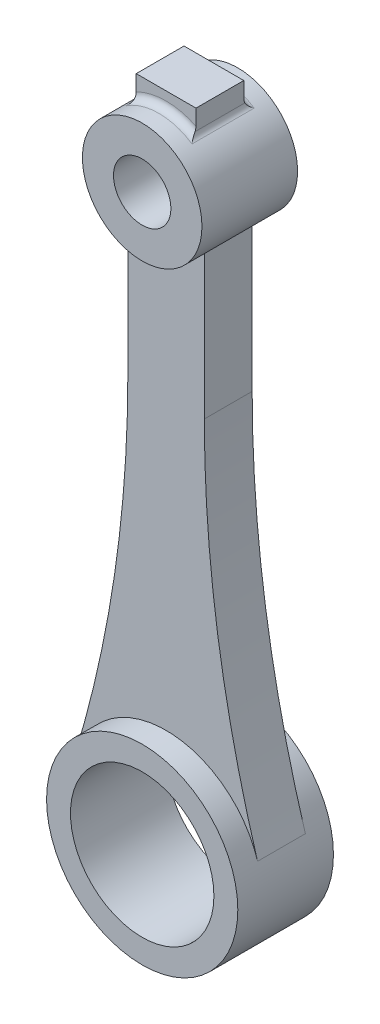
from build123d import *

# Parameters (mm, degrees)
SKETCH3_R             = 20
SKETCH3_R_2           = 15
BOSS_EXTRUDE3_DEPTH   = 10
SKETCH3_R_3           = 12.5
SKETCH3_R_4           = 6
BOSS_EXTRUDE3_2_DEPTH = 10
BOSS_EXTRUDE4_DEPTH   = 5
BOSS_EXTRUDE5_DEPTH   = 5
FILLET1_R             = 1.5


with BuildPart() as part:
    # Sketch3 → Boss-Extrude3 (new, symmetric)
    with BuildSketch(Plane.XY):
        Circle(SKETCH3_R)
        Circle(SKETCH3_R_2, mode=Mode.SUBTRACT)
    extrude(amount=BOSS_EXTRUDE3_DEPTH, both=True)



with BuildPart() as body_2:
    # Sketch3 → Boss-Extrude3 2 (new, symmetric)
    with BuildSketch(Plane.XY):
        with Locations((0, 120)):
            Circle(SKETCH3_R_3)
        with Locations((0, 120)):
            Circle(SKETCH3_R_4, mode=Mode.SUBTRACT)
    extrude(amount=BOSS_EXTRUDE3_2_DEPTH, both=True)


with BuildPart() as part_1:
    add(part.part)

    add(body_2.part)  # Boss-Extrude4 merges body 2
    # Sketch4 → Boss-Extrude4 (add, symmetric)
    with BuildSketch(Plane.XY):
        with BuildLine():
            Line((8, 110.395313644), (8, 80.395313644))
            ThreePointArc((8, 80.395313644), (10.797388085, 42.704875811), (19.128250996, 5.840377886))
            ThreePointArc((19.128250996, 5.840377886), (0, 20), (-19.128250996, 5.840377886))
            ThreePointArc((-19.128250996, 5.840377886), (-10.797388085, 42.704875811), (-8, 80.395313644))
            Line((-8, 80.395313644), (-8, 110.395313644))
            ThreePointArc((-8, 110.395313644), (0, 107.5), (8, 110.395313644))
        make_face()
    extrude(amount=BOSS_EXTRUDE4_DEPTH, both=True)

    # Sketch5 → Boss-Extrude5 (add, symmetric)
    with BuildSketch(Plane.XY):
        with BuildLine():
            Line((-6.25, 135.825317547), (-6.25, 130.825317547))
            ThreePointArc((-6.25, 130.825317547), (0, 132.5), (6.25, 130.825317547))
            Line((6.25, 130.825317547), (6.25, 135.825317547))
            Line((6.25, 135.825317547), (-6.25, 135.825317547))
        make_face()
    extrude(amount=BOSS_EXTRUDE5_DEPTH, both=True)

    # Fillet1
    fillet1_edges = [part_1.edges().sort_by_distance(p)[0] for p in [
        (0, 132.5, -5),
        (-6.25, 130.825317547, 0),
        (6.25, 130.825317547, 0),
        (0, 132.5, 5),
    ]]
    fillet(fillet1_edges, radius=FILLET1_R)


solid = part_1.part
